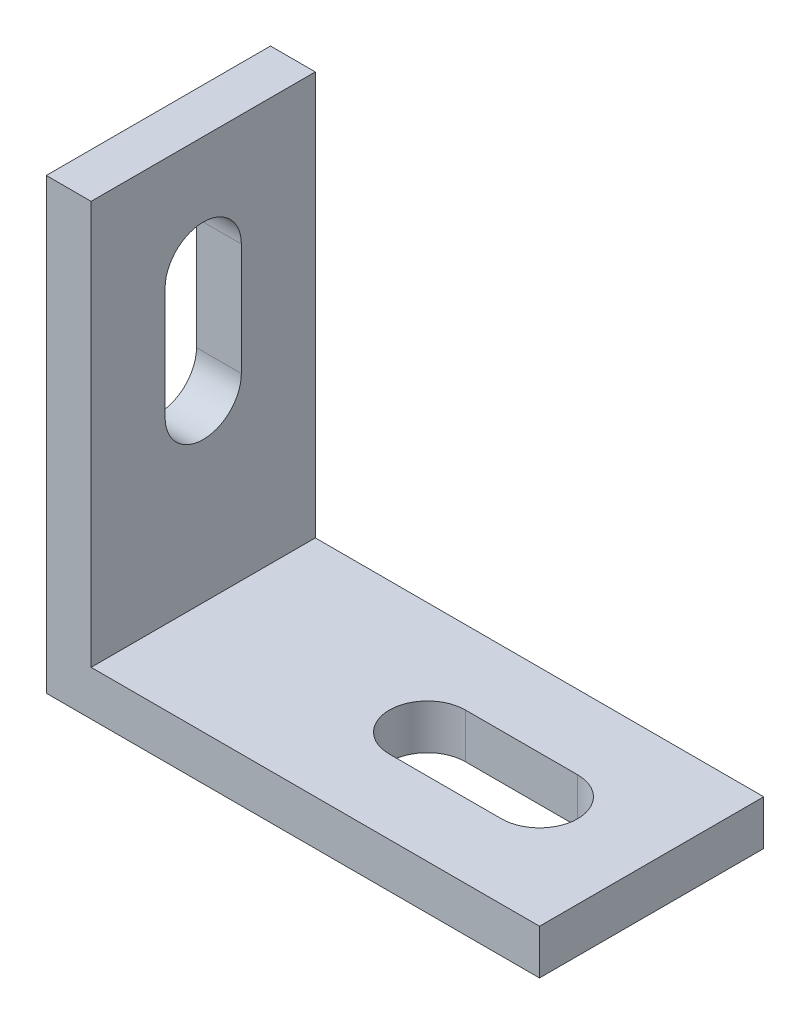
from build123d import *

# Parameters (mm, degrees)
SKETCH_1_W      = 20
SKETCH_1_H      = 10
EXTRUDE_1_DEPTH = 2
SKETCH_3_W      = 10
SKETCH_3_H      = 20
EXTRUDE_3_DEPTH = 2


with BuildPart() as part:
    # 草图1 → 凸台-拉伸1 (new body)
    with BuildSketch(Plane(origin=(0, 0, 0), x_dir=(1, 0, 0), z_dir=(0, 1, 0))):
        Rectangle(SKETCH_1_W, SKETCH_1_H)
        with BuildLine():
            Line((5, -1.7), (0, -1.7))
            ThreePointArc((0, -1.7), (-1.7, 0), (0, 1.7))
            Line((0, 1.7), (5, 1.7))
            ThreePointArc((5, 1.7), (6.7, 0), (5, -1.7))
        make_face(mode=Mode.SUBTRACT)
    extrude(amount=EXTRUDE_1_DEPTH)

    # 草图3 → 凸台-拉伸3 (add)
    with BuildSketch(Plane.ZY.offset(10)):
        with Locations((0, 10)):
            Rectangle(SKETCH_3_W, SKETCH_3_H)
        with BuildLine():
            Line((1.7, 15), (1.7, 10))
            ThreePointArc((1.7, 10), (0, 8.3), (-1.7, 10))
            Line((-1.7, 10), (-1.7, 15))
            ThreePointArc((-1.7, 15), (0, 16.7), (1.7, 15))
        make_face(mode=Mode.SUBTRACT)
    extrude(amount=EXTRUDE_3_DEPTH)


solid = part.part
